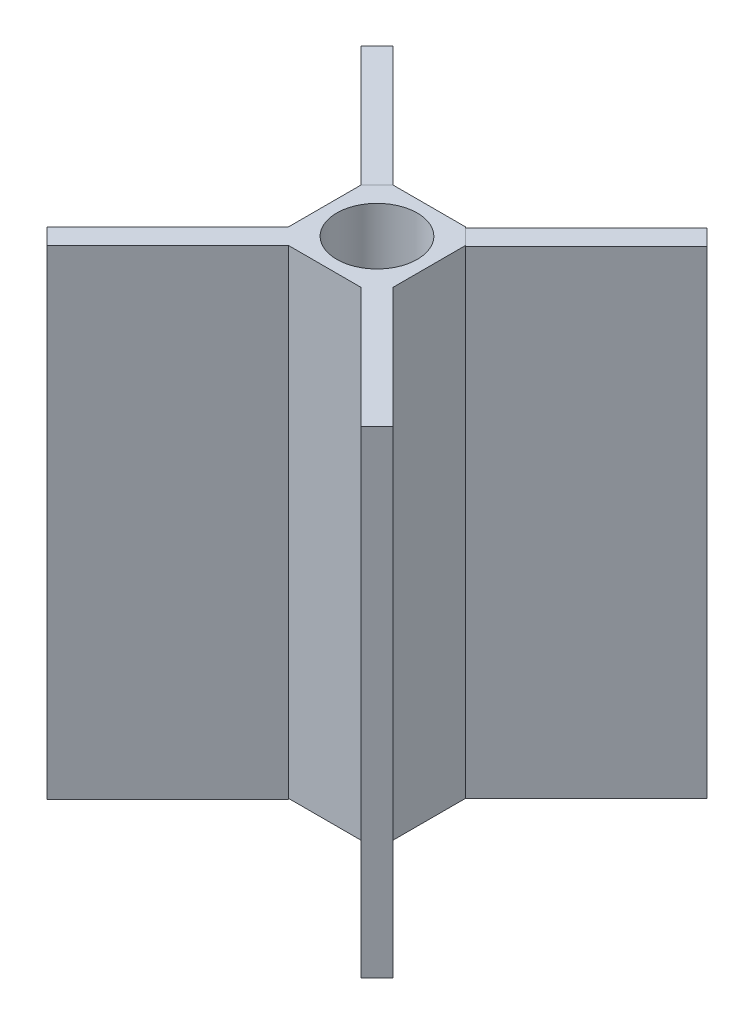
from build123d import *

# Parameters (mm, degrees)
SKETCH1_W           = 13
SKETCH1_H           = 13
BOSS_EXTRUDE1_DEPTH = 59.5
CHAMFER1_SIZE       = 2
SKETCH6_W           = 2.828427124
SKETCH6_H           = 59.370634799
BOSS_EXTRUDE3_DEPTH = 21.22
SKETCH5_W           = 2.828427124
SKETCH5_H           = 59.460523053
BOSS_EXTRUDE2_DEPTH = 21.22
SKETCH7_W           = 2.828427124
SKETCH7_H           = 59.614279407
BOSS_EXTRUDE4_DEPTH = 21.22
SKETCH8_W           = 2.828427124
SKETCH8_H           = 59.32576951
BOSS_EXTRUDE5_DEPTH = 21.22
SKETCH10_R          = 5
CUT_EXTRUDE2_DEPTH  = 67.923655478


with BuildPart() as part:
    # Sketch1 → Boss-Extrude1 (new body)
    with BuildSketch(Plane(origin=(0, 0, 0), x_dir=(1, 0, 0), z_dir=(0, 1, 0))):
        Rectangle(SKETCH1_W, SKETCH1_H)
    extrude(amount=BOSS_EXTRUDE1_DEPTH)

    # Chamfer1
    chamfer1_edges = [part.edges().sort_by_distance(p)[0] for p in [
        (6.5, 29.75, 6.5),
        (-6.5, 29.75, 6.5),
        (-6.5, 29.75, -6.5),
        (6.5, 29.75, -6.5),
    ]]
    chamfer(chamfer1_edges, length=CHAMFER1_SIZE)

    # Sketch6 → Boss-Extrude3 (add)
    with BuildSketch(Plane(origin=(5.5, 0, -5.5), x_dir=(-0.7071067811865465, 0, -0.7071067811865487), z_dir=(0.7071067811865487, 0, -0.7071067811865465))):
        with Locations((0, 29.6853174)):
            Rectangle(SKETCH6_W, SKETCH6_H)
    extrude(amount=BOSS_EXTRUDE3_DEPTH)

    # Sketch5 → Boss-Extrude2 (add)
    with BuildSketch(Plane(origin=(-5.5, 0, -5.5), x_dir=(-0.7071067811865487, 0, 0.7071067811865465), z_dir=(-0.7071067811865465, 0, -0.7071067811865487))):
        with Locations((0, 29.730261527)):
            Rectangle(SKETCH5_W, SKETCH5_H)
    extrude(amount=BOSS_EXTRUDE2_DEPTH)

    # Sketch7 → Boss-Extrude4 (add)
    with BuildSketch(Plane(origin=(-5.5, 0, 5.5), x_dir=(0.7071067811865465, 0, 0.7071067811865487), z_dir=(-0.7071067811865487, 0, 0.7071067811865465))):
        with Locations((0, 29.692860297)):
            Rectangle(SKETCH7_W, SKETCH7_H)
    extrude(amount=BOSS_EXTRUDE4_DEPTH)

    # Sketch8 → Boss-Extrude5 (add)
    with BuildSketch(Plane(origin=(5.5, 0, 5.5), x_dir=(0.7071067811865487, 0, -0.7071067811865465), z_dir=(0.7071067811865465, 0, 0.7071067811865487))):
        with Locations((0, 29.837115245)):
            Rectangle(SKETCH8_W, SKETCH8_H)
    extrude(amount=BOSS_EXTRUDE5_DEPTH)

    # Sketch10 → Cut-Extrude2 (cut, through all)
    with BuildSketch(Plane(origin=(0, 59.5, 0), x_dir=(1, 0, 0), z_dir=(0, 1, 0))):
        with Locations(Location((0, 0, 0), (0, 0, 270))):
            Circle(SKETCH10_R)
    extrude(amount=-CUT_EXTRUDE2_DEPTH, mode=Mode.SUBTRACT)


solid = part.part
